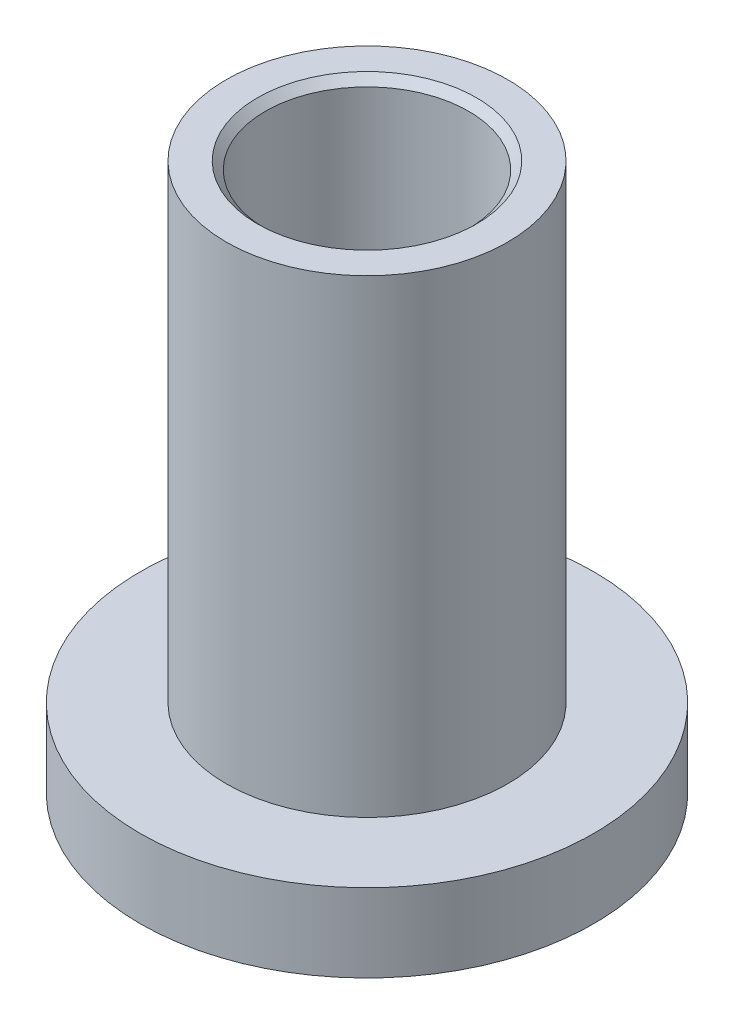
from build123d import *

# Parameters (mm, degrees)
SKETCH_1_R      = 29
EXTRUDE_1_DEPTH = 10
SKETCH_2_R      = 18
SKETCH_2_R_2    = 13
EXTRUDE_2_DEPTH = 60
CHAMFER_1_SIZE  = 1


with BuildPart() as part:
    # 草图1 → 凸台-拉伸1 (new body)
    with BuildSketch(Plane(origin=(0, 0, 0), x_dir=(1, 0, 0), z_dir=(0, 1, 0))):
        with Locations(Location((0, 0, 0), (0, 0, 270))):
            Circle(SKETCH_1_R)
    extrude(amount=EXTRUDE_1_DEPTH)

    # 草图2 → 凸台-拉伸2 (add)
    with BuildSketch(Plane(origin=(0, 10, 0), x_dir=(1, 0, 0), z_dir=(0, 1, 0))):
        with Locations(Location((0, 0, 0), (0, 0, 270))):
            Circle(SKETCH_2_R)
        with Locations(Location((0, 0, 0), (0, 0, 270))):
            Circle(SKETCH_2_R_2, mode=Mode.SUBTRACT)
    extrude(amount=EXTRUDE_2_DEPTH)

    # 倒角1
    chamfer_1_edges = [part.edges().sort_by_distance(p)[0] for p in [
        (0, 70, -13),
    ]]
    chamfer(chamfer_1_edges, length=CHAMFER_1_SIZE)


solid = part.part
